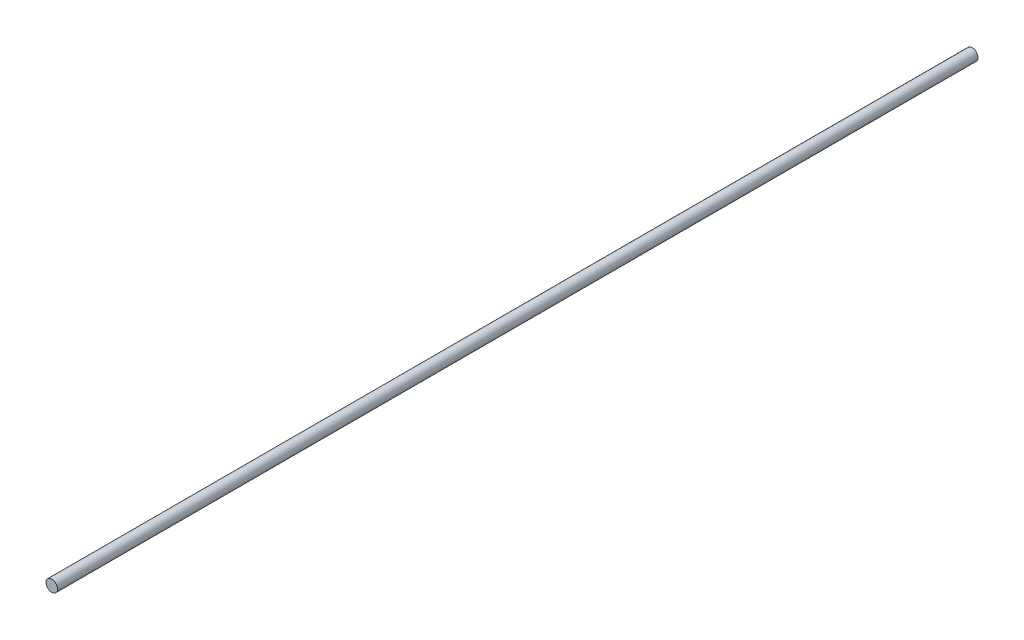
from build123d import *

# Parameters (mm, degrees)
SKETCH_1_R      = 4
EXTRUDE_1_DEPTH = 640


with BuildPart() as part:
    # 스케치1 → 보스-돌출1 (new body)
    with BuildSketch(Plane.XY):
        Circle(SKETCH_1_R)
    extrude(amount=EXTRUDE_1_DEPTH)


solid = part.part
